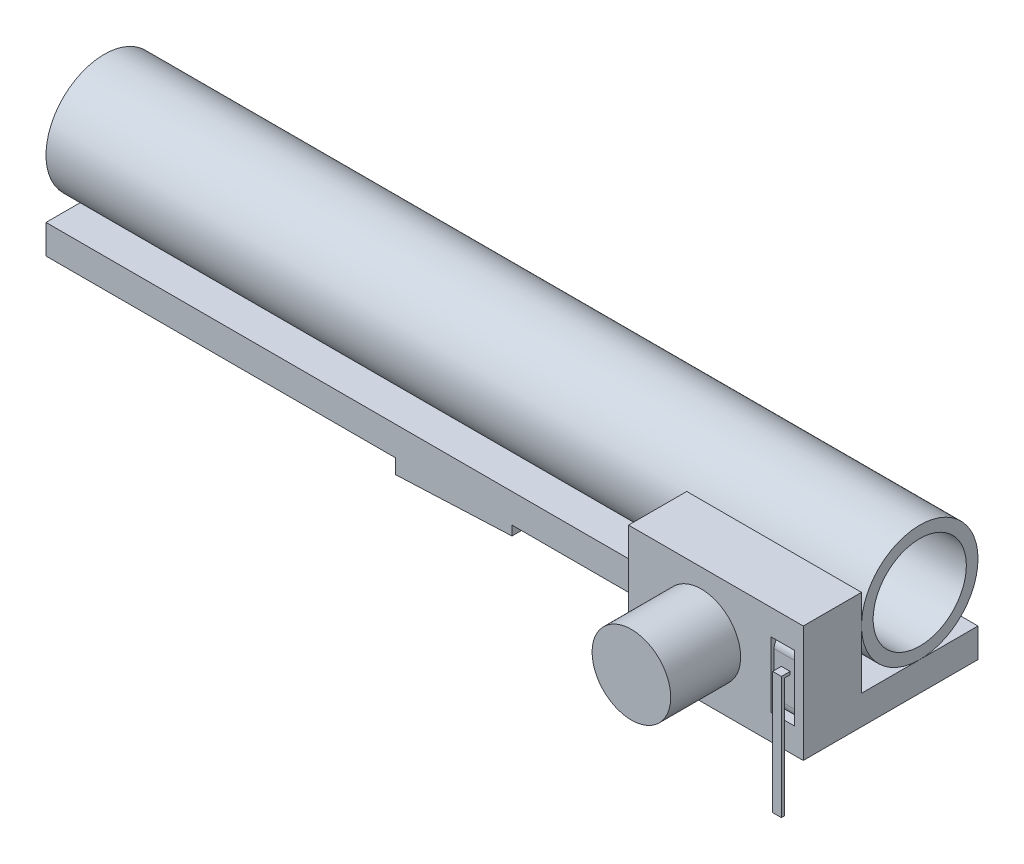
from build123d import *

# Parameters (mm, degrees)
SKETCH3_R                = 25.4
BOSS_EXTRUDE1_DEPTH      = 355.6
SHELL1_T                 = -5.08
BOSS_EXTRUDE2_DEPTH      = 25.4
BOSS_EXTRUDE2_DEPTH_BACK = 25.4
SKETCH4_W                = 355.6
SKETCH4_H                = 12.7
SKETCH5_W                = 76.2
SKETCH5_H                = 50.8
BOSS_EXTRUDE3_DEPTH      = 25.4
SKETCH6_W                = 10.16
SKETCH6_H                = 28.575
CUT_EXTRUDE1_DEPTH       = 19.05
BOSS_EXTRUDE4_REACH      = 349.481
SKETCH8_W                = 3.81
SKETCH8_H                = 1.27
BOSS_EXTRUDE5_DEPTH      = 2.54
SKETCH10_W               = 3.81
SKETCH10_H               = 53.34
BOSS_EXTRUDE6_DEPTH      = 1.27
SKETCH11_R               = 17.145
BOSS_EXTRUDE7_DEPTH      = 30.48
BOSS_EXTRUDE8_START      = -25.4
BOSS_EXTRUDE8_DEPTH      = 50.8


with BuildPart() as part:
    # Sketch3 → Boss-Extrude1 (new body)
    with BuildSketch(Plane(origin=(0, 0, 0), x_dir=(0, 0, -1), z_dir=(1, 0, 0))):
        Circle(SKETCH3_R)
    extrude(amount=-BOSS_EXTRUDE1_DEPTH)

    # Shell1
    shell1_openings = [part.faces().sort_by_distance(p)[0] for p in [
        (0, 0, 0),
    ]]
    offset(amount=SHELL1_T, openings=shell1_openings, kind=Kind.INTERSECTION)


with BuildPart() as body_2:
    # Sketch4 → Boss-Extrude2 (new, two sides: drawn at the far end of the back side and taken through both)
    with BuildSketch(Plane.XY.offset(-BOSS_EXTRUDE2_DEPTH_BACK)):
        with Locations((-177.8, -31.75)):
            Rectangle(SKETCH4_W, SKETCH4_H)
    extrude(amount=BOSS_EXTRUDE2_DEPTH + BOSS_EXTRUDE2_DEPTH_BACK)

    # Sketch5 → Boss-Extrude3 (add)
    with BuildSketch(Plane.XY.offset(25.4)):
        with Locations((-38.1, -12.7)):
            Rectangle(SKETCH5_W, SKETCH5_H)
    extrude(amount=BOSS_EXTRUDE3_DEPTH)

    # Sketch6 → Cut-Extrude1 (cut)
    with BuildSketch(Plane.XY.offset(50.8)):
        with Locations((-8.89, -12.7)):
            Rectangle(SKETCH6_W, SKETCH6_H)
    extrude(amount=-CUT_EXTRUDE1_DEPTH, mode=Mode.SUBTRACT)

    # Sketch7 → Boss-Extrude4 (add, up to next)
    with BuildSketch(Plane(origin=(-13.97, 0, 0), x_dir=(0, 0, -1), z_dir=(1, 0, 0)), mode=Mode.PRIVATE) as boss_extrude4_sk1:
        with BuildLine():
            Line((-44.45, -26.9875), (-36.83, -26.9875))
            ThreePointArc((-36.83, -26.9875), (-33.237897552, -25.499602448), (-31.75, -21.9075))
            Line((-31.75, -21.9075), (-31.75, -3.4925))
            ThreePointArc((-31.75, -3.4925), (-33.237897552, 0.099602448), (-36.83, 1.5875))
            Line((-36.83, 1.5875), (-44.45, 1.5875))
            ThreePointArc((-44.45, 1.5875), (-48.042102448, 0.099602448), (-49.53, -3.4925))
            Line((-49.53, -3.4925), (-49.53, -21.9075))
            ThreePointArc((-49.53, -21.9075), (-48.042102448, -25.499602448), (-44.45, -26.9875))
        make_face()
    boss_extrude4_tool1 = extrude(boss_extrude4_sk1.sketch, amount=BOSS_EXTRUDE4_REACH, mode=Mode.PRIVATE) - body_2.part
    add(boss_extrude4_tool1.solids().sort_by_distance((-13.97, -12.7, 40.64))[0])

    # Sketch8 → Boss-Extrude5 (add)
    with BuildSketch(Plane.XY.offset(49.53)):
        with Locations((-8.89, -9.2075)):
            Rectangle(SKETCH8_W, SKETCH8_H)
    extrude(amount=BOSS_EXTRUDE5_DEPTH)

    # Sketch10 → Boss-Extrude6 (add)
    with BuildSketch(Plane.XY.offset(52.07)):
        with Locations((-8.89, -35.2425)):
            Rectangle(SKETCH10_W, SKETCH10_H)
    extrude(amount=BOSS_EXTRUDE6_DEPTH)

    # Sketch11 → Boss-Extrude7 (add)
    with BuildSketch(Plane.XY.offset(50.8)):
        with Locations(Location((-44.45, -12.7, 0), (0, 0, 180))):
            Circle(SKETCH11_R)
    extrude(amount=BOSS_EXTRUDE7_DEPTH)

    # Sketch12 → Boss-Extrude8 (add)
    with BuildSketch(Plane.XY.offset(BOSS_EXTRUDE8_START)):
        Polygon((-203.151649656, -44.45), (-152.4, -42.234135122), (-152.4, -38.1), (-203.151649656, -38.1), align=None)
    extrude(amount=BOSS_EXTRUDE8_DEPTH)


solid = Compound([part.part, body_2.part])
